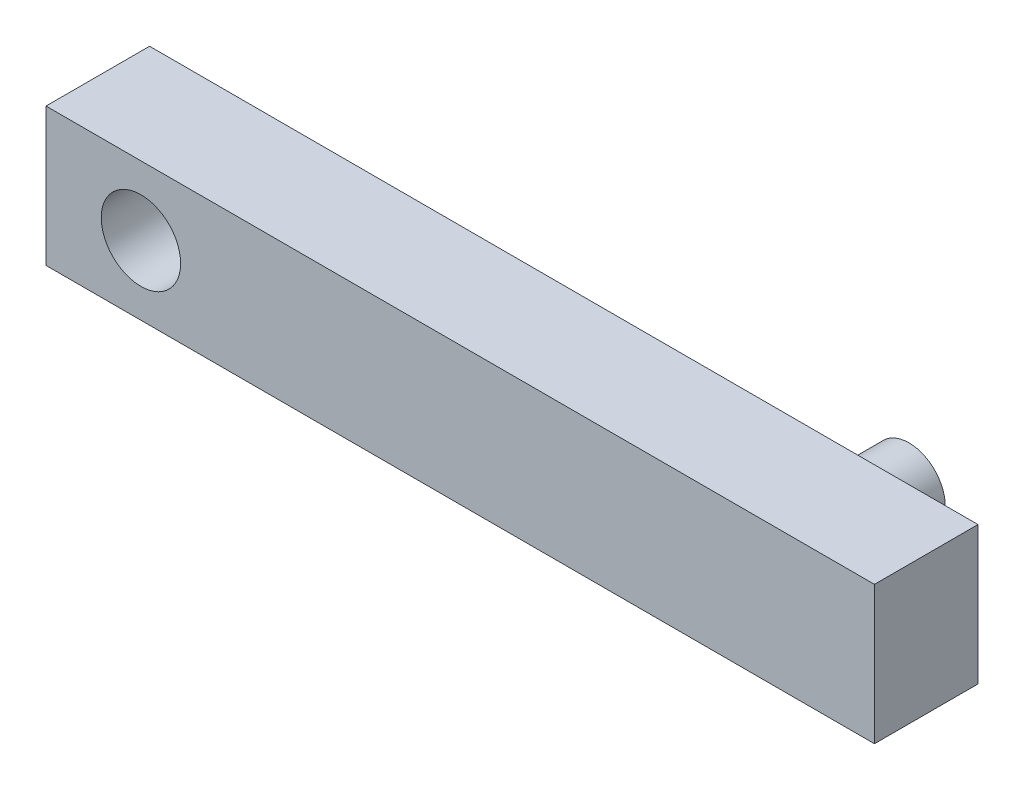
from build123d import *

# Parameters (mm, degrees)
CROQUIS1_W              = 24
CROQUIS1_H              = 4
SALIENTE_EXTRUIR1_DEPTH = 3
CROQUIS4_R              = 1.15
CORTAR_EXTRUIR2_DEPTH   = 25.515301344
CROQUIS3_R              = 1.05
SALIENTE_EXTRUIR3_DEPTH = 2


with BuildPart() as part:
    # Croquis1 → Saliente-Extruir1 (new body)
    with BuildSketch(Plane.XY):
        with Locations((12, -2)):
            Rectangle(CROQUIS1_W, CROQUIS1_H)
    extrude(amount=SALIENTE_EXTRUIR1_DEPTH)

    # Croquis4 → Cortar-Extruir2 (cut, through all)
    with BuildSketch(Plane.XY.offset(3)):
        with Locations((2.75, -2)):
            Circle(CROQUIS4_R)
    extrude(amount=-CORTAR_EXTRUIR2_DEPTH, mode=Mode.SUBTRACT)

    # Croquis3 → Saliente-Extruir3 (add)
    with BuildSketch(Plane(origin=(0, 0, 0), x_dir=(-1, 0, 0), z_dir=(0, 0, -1))):
        with Locations(Location((-20, -2, 0), (0, 0, 180))):
            Circle(CROQUIS3_R)
    extrude(amount=SALIENTE_EXTRUIR3_DEPTH)


solid = part.part
